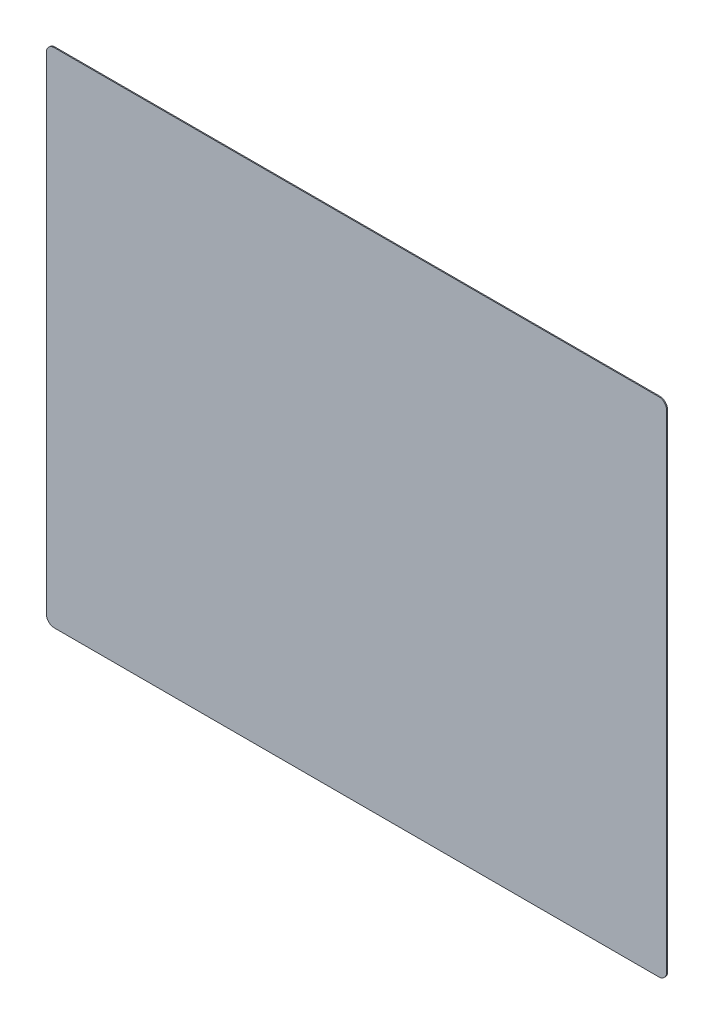
from build123d import *

# Parameters (mm, degrees)
SKETCH1_W           = 1003.3
SKETCH1_H           = 812.8
BOSS_EXTRUDE1_DEPTH = 1.5875
FILLET1_R           = 12.7


with BuildPart() as part:
    # Sketch1 → Boss-Extrude1 (new body)
    with BuildSketch(Plane.XY):
        Rectangle(SKETCH1_W, SKETCH1_H)
    extrude(amount=BOSS_EXTRUDE1_DEPTH)

    # Fillet1
    fillet1_edges = [part.edges().sort_by_distance(p)[0] for p in [
        (501.65, -406.4, 0.79375),
        (-501.65, -406.4, 0.79375),
        (-501.65, 406.4, 0.79375),
        (501.65, 406.4, 0.79375),
    ]]
    fillet(fillet1_edges, radius=FILLET1_R)


solid = part.part
